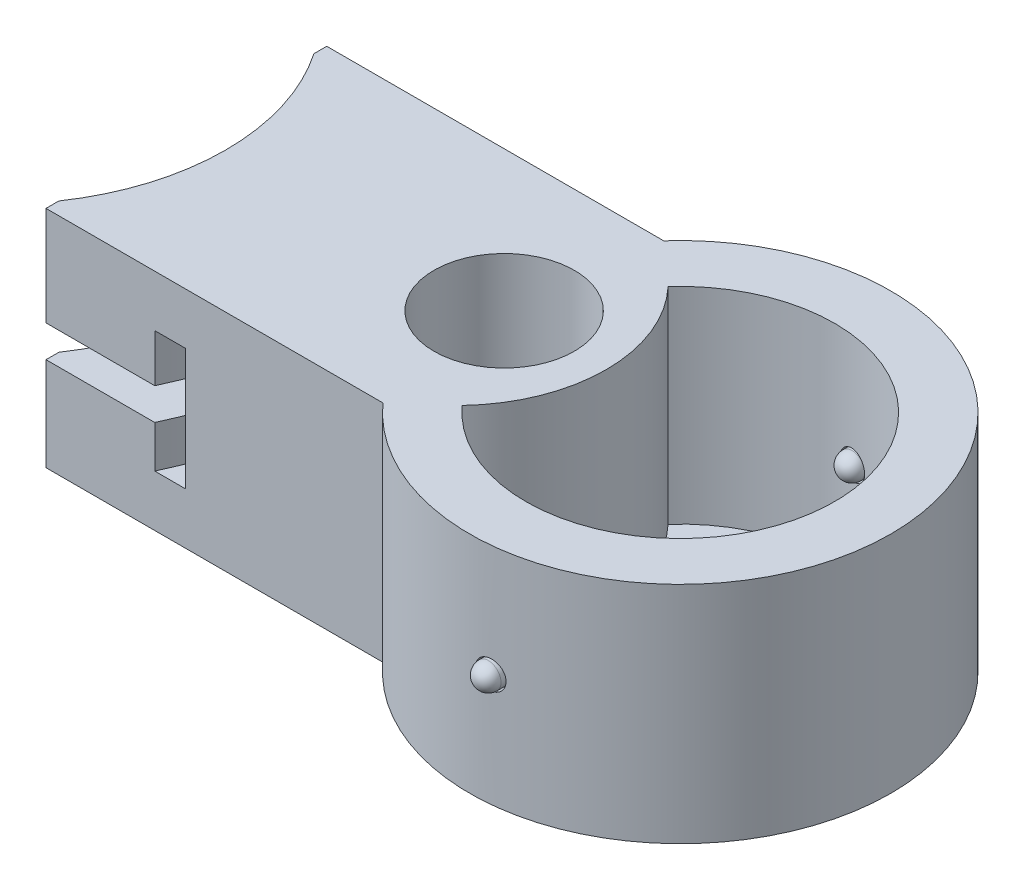
from build123d import *

# Parameters (mm, degrees)
BOSS_EXTRUDE1_DEPTH     = 15.24
CUT_EXTRUDE1_DEPTH      = 27.94
CUT_EXTRUDE2_DEPTH      = 101.930245942
CUT_EXTRUDE2_DEPTH_BACK = 101.930245942
SKETCH4_R               = 1.905
SKETCH6_R               = 9.525
CUT_EXTRUDE3_DEPTH      = 105.836564482


with BuildPart() as part:
    # Sketch1 → Boss-Extrude1 (new, symmetric)
    with BuildSketch(Plane(origin=(0, 0, 0), x_dir=(1, 0, 0), z_dir=(0, 1, 0))):
        with BuildLine():
            Line((0, 19.05), (45.72, 19.05))
            ThreePointArc((45.72, 19.05), (95.593547486, 0), (45.72, -19.05))
            Line((45.72, -19.05), (0, -19.05))
            Line((0, -19.05), (0, 19.05))
        make_face()
    extrude(amount=BOSS_EXTRUDE1_DEPTH, both=True)

    # Sketch3 → Cut-Extrude1 (cut)
    with BuildSketch(Plane(origin=(0, 15.24, 0), x_dir=(1, 0, 0), z_dir=(0, 1, 0))):
        with BuildLine():
            ThreePointArc((51.399612663, 13.97), (56.963546114, 0), (51.399612663, -13.97))
            ThreePointArc((51.399612663, -13.97), (87.973547486, 0), (51.399612663, 13.97))
        make_face()
    extrude(amount=-CUT_EXTRUDE1_DEPTH, mode=Mode.SUBTRACT)

    # Sketch4 → Cut-Extrude2 (cut, two sides: drawn at the far end of the back side and taken through both)
    with BuildSketch(Plane.XY.offset(-CUT_EXTRUDE2_DEPTH_BACK)):
        with Locations((69.685547486, 0)):
            Circle(SKETCH4_R)
    extrude(amount=CUT_EXTRUDE2_DEPTH + CUT_EXTRUDE2_DEPTH_BACK, mode=Mode.SUBTRACT)

    # Sketch2 → Cut-Revolve1 (revolve, cut)
    with BuildSketch(Plane.XY):
        Polygon((-3.048, 17.145), (5.334, 17.145), (5.334, 1.778), (19.05, 1.778), (19.05, 8.255), (22.86, 8.255), (22.86, -8.255), (19.05, -8.255), (19.05, -2.54), (5.334, -2.54), (5.334, -17.145), (-3.048, -17.145), align=None)
    revolve(axis=Axis((-25.4, 18.8595, 0), (0, -1, 0)), mode=Mode.SUBTRACT)

    # Sketch6 → Cut-Extrude3 (cut, through all)
    with BuildSketch(Plane(origin=(0, 15.24, 0), x_dir=(1, 0, 0), z_dir=(0, 1, 0))):
        with Locations(Location((43.11933437, 0, 0), (0, 0, 270))):
            Circle(SKETCH6_R)
    extrude(amount=-CUT_EXTRUDE3_DEPTH, mode=Mode.SUBTRACT)


with BuildPart() as body_2:
    # Sketch5 → Revolve1 (revolve)
    with BuildSketch(Plane(origin=(0, 0, 0), x_dir=(1, 0, 0), z_dir=(0, 1, 0))):
        with BuildLine():
            ThreePointArc((71.361947486, -28.242972603), (70.499961748, -28.362129323), (69.634747486, -28.454984143))
            Line((69.634747486, -28.454984143), (69.634747486, -30.389940871))
            ThreePointArc((69.634747486, -30.389940871), (70.856062318, -29.884055704), (71.361947486, -28.662740871))
            Line((71.361947486, -28.662740871), (71.361947486, -28.242972603))
        make_face()
        with BuildLine():
            ThreePointArc((71.351999268, -20.502029671), (70.496376886, -20.66438307), (69.634747486, -20.791044287))
            Line((69.634747486, -20.791044287), (69.634747486, -28.454984143))
            ThreePointArc((69.634747486, -28.454984143), (70.499961748, -28.362129323), (71.361947486, -28.242972603))
            Line((71.361947486, -28.242972603), (71.361947486, -20.687140871))
            ThreePointArc((71.361947486, -20.687140871), (71.359458638, -20.594451709), (71.351999268, -20.502029671))
        make_face()
        with BuildLine():
            ThreePointArc((71.351999268, -20.502029671), (70.788761302, -19.402044785), (69.634747486, -18.959940871))
            Line((69.634747486, -18.959940871), (69.634747486, -20.791044287))
            ThreePointArc((69.634747486, -20.791044287), (70.496376886, -20.66438307), (71.351999268, -20.502029671))
        make_face()
    revolve(axis=Axis((69.634747486, 0, 18.959940871), (0, 0, 1)))


with BuildPart() as body_3:
    # Mirror1: mirrored copy
    add(body_2.part.mirror(Plane.XY))


solid = Compound([part.part, body_2.part, body_3.part])
